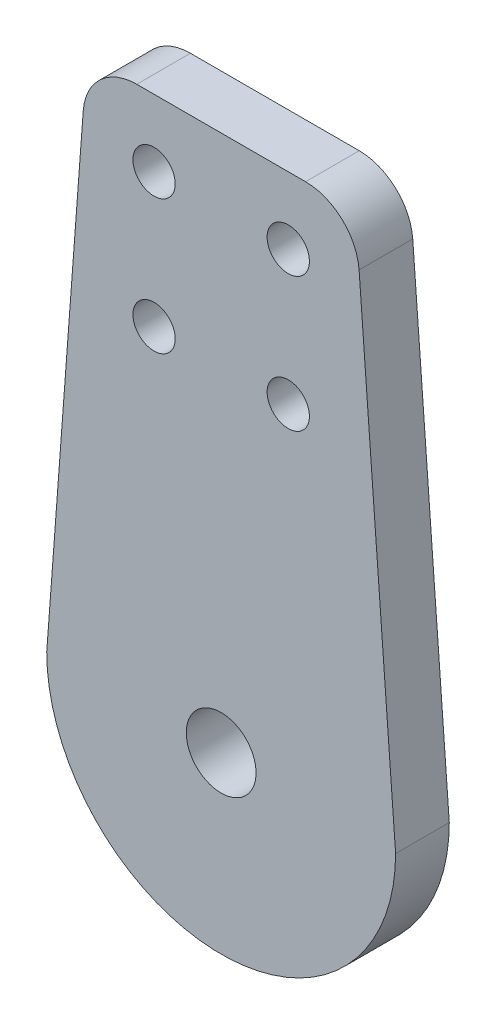
from build123d import *

# Parameters (mm, degrees)
SKETCH_1_W          = 20
SKETCH_1_H          = 40
EXTRUDE_1_DEPTH     = 4
SKETCH_5_R          = 1.575
CUT_EXTRUDE_2_DEPTH = 45.899888641
EXTRUDE_2_DEPTH     = 4
SKETCH_11_R         = 2.6
CUT_EXTRUDE_3_DEPTH = 58.913728942
FILLET_1_R          = 4


with BuildPart() as part:
    # 草图1 → 凸台-拉伸1 (new body)
    with BuildSketch(Plane.XY):
        with Locations((10, -20)):
            Rectangle(SKETCH_1_W, SKETCH_1_H)
    extrude(amount=EXTRUDE_1_DEPTH)

    # 草图5 → 切除-拉伸2 (cut, through all)
    with BuildSketch(Plane.XY.offset(4)):
        with Locations((5, -5)):
            Circle(SKETCH_5_R)
        with Locations(Location((15, -5, 0), (0, 0, 180))):
            Circle(SKETCH_5_R)
        with Locations((15, -15)):
            Circle(SKETCH_5_R)
        with Locations(Location((5, -15, 0), (0, 0, 180))):
            Circle(SKETCH_5_R)
    extrude(amount=-CUT_EXTRUDE_2_DEPTH, mode=Mode.SUBTRACT)

    # 草图10 → 凸台-拉伸2 (add)
    with BuildSketch(Plane(origin=(0, 0, 0), x_dir=(-1, 0, 0), z_dir=(0, 0, -1))):
        Polygon((-23, -40), (-20, 0), (-20, -40), align=None)
        Polygon((0, -40), (3, -40), (0, 0), align=None)
        with BuildLine():
            Line((0, -40), (-20, -40))
            Line((-20, -40), (-23, -40))
            ThreePointArc((-23, -40), (-10, -53), (3, -40))
            Line((3, -40), (0, -40))
        make_face()
    extrude(amount=-EXTRUDE_2_DEPTH)

    # 草图11 → 切除-拉伸3 (cut, through all)
    with BuildSketch(Plane(origin=(0, 0, 0), x_dir=(-1, 0, 0), z_dir=(0, 0, -1))):
        with Locations((-10, -40)):
            Circle(SKETCH_11_R)
    extrude(amount=-CUT_EXTRUDE_3_DEPTH, mode=Mode.SUBTRACT)

    # 圆角1
    fillet_1_edges = [part.edges().sort_by_distance(p)[0] for p in [
        (0, 0, 2),
        (20, 0, 2),
    ]]
    fillet(fillet_1_edges, radius=FILLET_1_R)


solid = part.part
